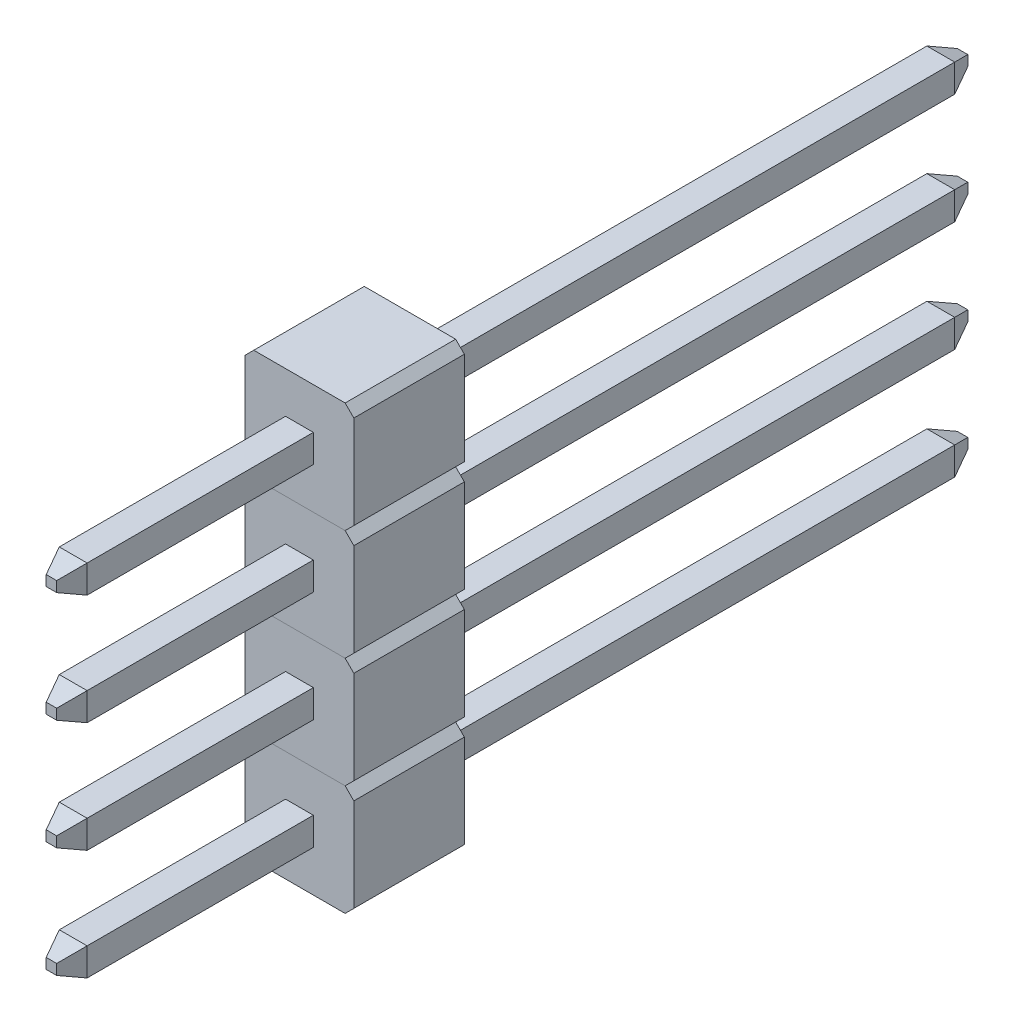
from build123d import *
from OCP.BRepFilletAPI import BRepFilletAPI_MakeChamfer

# Parameters (mm, degrees)
ESQUISSE1_W                = 2.5
ESQUISSE1_H                = 2.54
BASE_DEPTH                 = 2.54
ESQUISSE3_W                = 0.64
ESQUISSE3_H                = 0.64
EXTRUDE_A_DEPTH            = 5.7
ESQUISSE4_W                = 0.64
ESQUISSE4_H                = 0.64
EXTRUDE_B_DEPTH            = 12.7
CHANFREIN2_SIZE            = 0.2
CHANFREIN3_SIZE            = 0.5
CHANFREIN3_SIZE2           = 0.2
R_P_TITION_LIN_AIRE2_COUNT = 4
R_P_TITION_LIN_AIRE2_PITCH = 2.54


with BuildPart() as part:
    # Esquisse1 → Base (new body)
    with BuildSketch(Plane.XY):
        Rectangle(ESQUISSE1_W, ESQUISSE1_H)
    extrude(amount=BASE_DEPTH)

    # Esquisse3 → A (add)
    with BuildSketch(Plane.XY.offset(2.54)):
        Rectangle(ESQUISSE3_W, ESQUISSE3_H)
    extrude(amount=EXTRUDE_A_DEPTH)

    # Esquisse4 → B (add)
    with BuildSketch(Plane(origin=(0, 0, 0), x_dir=(-1, 0, 0), z_dir=(0, 0, -1))):
        Rectangle(ESQUISSE4_W, ESQUISSE4_H)
    extrude(amount=EXTRUDE_B_DEPTH)

    # Chanfrein2
    chanfrein2_edges = [part.edges().sort_by_distance(p)[0] for p in [
        (1.25, -1.27, 1.27),
        (-1.25, -1.27, 1.27),
        (-1.25, 1.27, 1.27),
        (1.25, 1.27, 1.27),
    ]]
    chamfer(chanfrein2_edges, length=CHANFREIN2_SIZE)

    # Chanfrein3: one chamfer whose edges measure the first distance from different faces: ONE call of the kernel's chamfer builder (chamfer() names one face for all edges)
    chanfrein3_edges_1 = [part.edges().sort_by_distance(p)[0] for p in [
        (0.32, 0, 8.24),
    ]]
    chanfrein3_side_1 = [part.faces().sort_by_distance(p)[0] for p in [
        (0.32, 0, 5.39),
    ]]
    chanfrein3_edges_2 = [part.edges().sort_by_distance(p)[0] for p in [
        (0, 0.32, 8.24),
    ]]
    chanfrein3_side_2 = [part.faces().sort_by_distance(p)[0] for p in [
        (0, 0.32, 5.39),
    ]]
    chanfrein3_edges_3 = [part.edges().sort_by_distance(p)[0] for p in [
        (-0.32, 0, 8.24),
    ]]
    chanfrein3_side_3 = [part.faces().sort_by_distance(p)[0] for p in [
        (-0.32, 0, 5.39),
    ]]
    chanfrein3_edges_4 = [part.edges().sort_by_distance(p)[0] for p in [
        (0, -0.32, 8.24),
    ]]
    chanfrein3_side_4 = [part.faces().sort_by_distance(p)[0] for p in [
        (0, -0.32, 5.39),
    ]]
    chanfrein3_edges_5 = [part.edges().sort_by_distance(p)[0] for p in [
        (-0.32, 0, -12.7),
    ]]
    chanfrein3_side_5 = [part.faces().sort_by_distance(p)[0] for p in [
        (-0.32, 0, -6.35),
    ]]
    chanfrein3_edges_6 = [part.edges().sort_by_distance(p)[0] for p in [
        (0, 0.32, -12.7),
    ]]
    chanfrein3_side_6 = [part.faces().sort_by_distance(p)[0] for p in [
        (0, 0.32, -6.35),
    ]]
    chanfrein3_edges_7 = [part.edges().sort_by_distance(p)[0] for p in [
        (0.32, 0, -12.7),
    ]]
    chanfrein3_side_7 = [part.faces().sort_by_distance(p)[0] for p in [
        (0.32, 0, -6.35),
    ]]
    chanfrein3_edges_8 = [part.edges().sort_by_distance(p)[0] for p in [
        (0, -0.32, -12.7),
    ]]
    chanfrein3_side_8 = [part.faces().sort_by_distance(p)[0] for p in [
        (0, -0.32, -6.35),
    ]]
    chanfrein3 = BRepFilletAPI_MakeChamfer(part.part.solid().wrapped)
    for e in chanfrein3_edges_1:
        chanfrein3.Add(CHANFREIN3_SIZE, CHANFREIN3_SIZE2, e.wrapped, chanfrein3_side_1[0].wrapped)  # the first distance lies on this face
    for e in chanfrein3_edges_2:
        chanfrein3.Add(CHANFREIN3_SIZE, CHANFREIN3_SIZE2, e.wrapped, chanfrein3_side_2[0].wrapped)  # the first distance lies on this face
    for e in chanfrein3_edges_3:
        chanfrein3.Add(CHANFREIN3_SIZE, CHANFREIN3_SIZE2, e.wrapped, chanfrein3_side_3[0].wrapped)  # the first distance lies on this face
    for e in chanfrein3_edges_4:
        chanfrein3.Add(CHANFREIN3_SIZE, CHANFREIN3_SIZE2, e.wrapped, chanfrein3_side_4[0].wrapped)  # the first distance lies on this face
    for e in chanfrein3_edges_5:
        chanfrein3.Add(CHANFREIN3_SIZE, CHANFREIN3_SIZE2, e.wrapped, chanfrein3_side_5[0].wrapped)  # the first distance lies on this face
    for e in chanfrein3_edges_6:
        chanfrein3.Add(CHANFREIN3_SIZE, CHANFREIN3_SIZE2, e.wrapped, chanfrein3_side_6[0].wrapped)  # the first distance lies on this face
    for e in chanfrein3_edges_7:
        chanfrein3.Add(CHANFREIN3_SIZE, CHANFREIN3_SIZE2, e.wrapped, chanfrein3_side_7[0].wrapped)  # the first distance lies on this face
    for e in chanfrein3_edges_8:
        chanfrein3.Add(CHANFREIN3_SIZE, CHANFREIN3_SIZE2, e.wrapped, chanfrein3_side_8[0].wrapped)  # the first distance lies on this face
    add(Compound.cast(chanfrein3.Shape()), mode=Mode.REPLACE)


with BuildPart() as r_p_tition_lin_aire2_1:
    # Répétition linéaire2: pattern copy
    add(part.part.moved(Location(Vector(0, 1, 0) * (1 * R_P_TITION_LIN_AIRE2_PITCH))))


with BuildPart() as r_p_tition_lin_aire2_2:
    # Répétition linéaire2: pattern copy
    add(part.part.moved(Location(Vector(0, 1, 0) * (2 * R_P_TITION_LIN_AIRE2_PITCH))))


with BuildPart() as r_p_tition_lin_aire2_3:
    # Répétition linéaire2: pattern copy
    add(part.part.moved(Location(Vector(0, 1, 0) * (3 * R_P_TITION_LIN_AIRE2_PITCH))))


solid = Compound([part.part, r_p_tition_lin_aire2_1.part, r_p_tition_lin_aire2_2.part, r_p_tition_lin_aire2_3.part])
